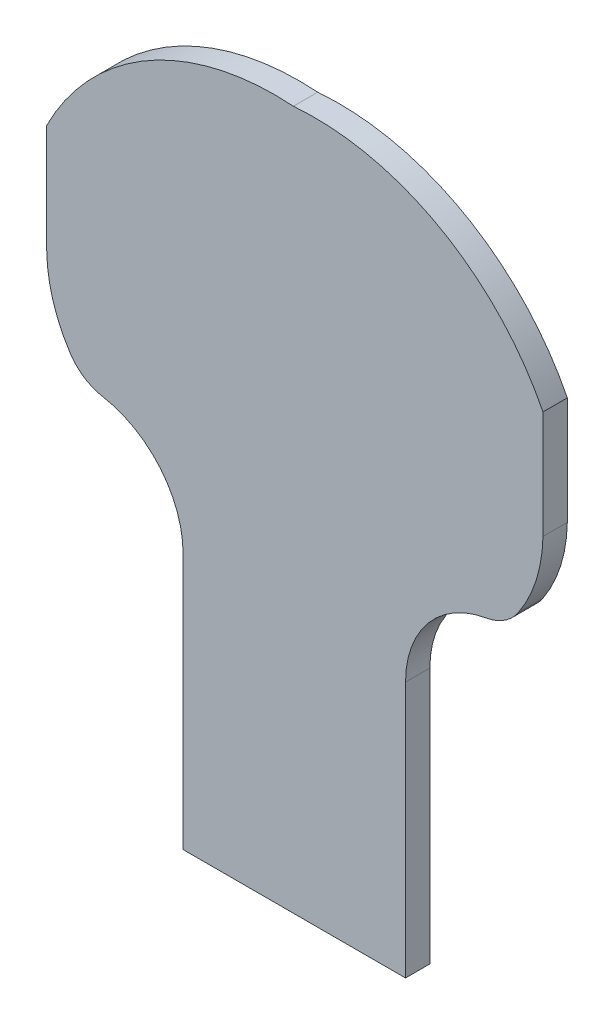
from build123d import *

# Parameters (mm, degrees)
EXTRUDE_1_DEPTH = 5


with BuildPart() as part:
    # Эскиз1 → Вытянуть1 (new body)
    with BuildSketch(Plane.XY):
        with BuildLine():
            Line((51.051218407, 63.479620652), (51.051218407, 85.650578056))
            ThreePointArc((51.051218407, 85.650578056), (29.802221193, 107.884883156), (-0.253175823, 114.408480022))
            ThreePointArc((-0.253175823, 114.408480022), (-29.956404055, 107.707451089), (-50.948781593, 85.650578205))
            Line((-50.948781593, 85.650578205), (-50.948781593, 63.479620652))
            ThreePointArc((-50.948781593, 63.479620652), (-49.676003697, 55.151129839), (-46.113662299, 47.516115329))
            ThreePointArc((-46.113662299, 47.516115329), (-43.24429549, 44.636868096), (-39.466032041, 43.137516297))
            ThreePointArc((-39.466032041, 43.137516297), (-27.599168456, 36.303107276), (-22.910878505, 23.436424124))
            Line((-22.910878505, 23.436424124), (-22.910878505, -29.232372122))
            Line((-22.910878505, -29.232372122), (22.801652741, -29.232372122))
            Line((22.801652741, -29.232372122), (22.801652741, 23.436424124))
            ThreePointArc((22.801652741, 23.436424124), (27.504627406, 36.320562274), (39.401754329, 43.145322895))
            ThreePointArc((39.401754329, 43.145322895), (43.142841115, 44.60959187), (46.005754814, 47.428020354))
            ThreePointArc((46.005754814, 47.428020354), (49.685829012, 55.090035656), (51.051218407, 63.479620652))
        make_face()
    extrude(amount=EXTRUDE_1_DEPTH)


solid = part.part
